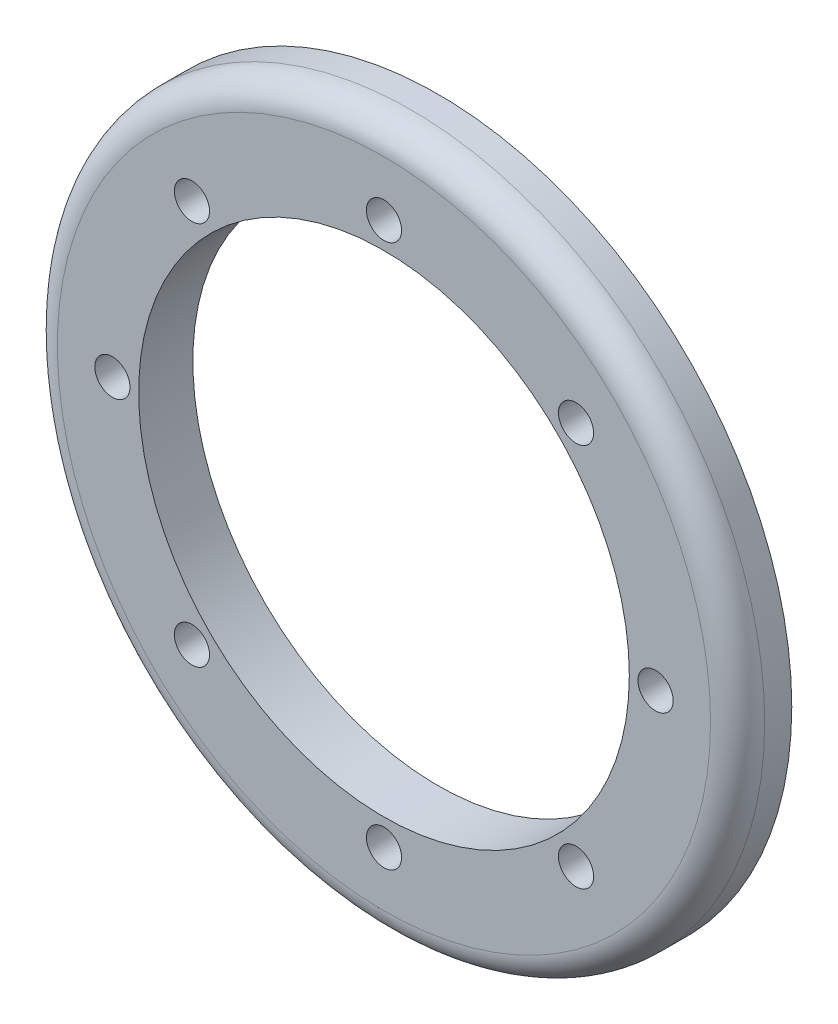
from build123d import *

# Parameters (mm, degrees)
SKETCH1_R           = 65.3
SKETCH1_R_2         = 45.3
SKETCH1_R_3         = 1.65
BOSS_EXTRUDE1_DEPTH = 10
FILLET1_R           = 5
SKETCH2_R           = 3.25
CUT_EXTRUDE1_DEPTH  = 6


with BuildPart() as part:
    # Sketch1 → Boss-Extrude1 (new body)
    with BuildSketch(Plane.XY):
        Circle(SKETCH1_R)
        Circle(SKETCH1_R_2, mode=Mode.SUBTRACT)
        with Locations((35.461405077, -35.461405077)):
            Circle(SKETCH1_R_3, mode=Mode.SUBTRACT)
        with Locations((0, -50.15)):
            Circle(SKETCH1_R_3, mode=Mode.SUBTRACT)
        with Locations((-35.461405077, -35.461405077)):
            Circle(SKETCH1_R_3, mode=Mode.SUBTRACT)
        with Locations((-50.15, 0)):
            Circle(SKETCH1_R_3, mode=Mode.SUBTRACT)
        with Locations((-35.461405077, 35.461405077)):
            Circle(SKETCH1_R_3, mode=Mode.SUBTRACT)
        with Locations((0, 50.15)):
            Circle(SKETCH1_R_3, mode=Mode.SUBTRACT)
        with Locations((35.461405077, 35.461405077)):
            Circle(SKETCH1_R_3, mode=Mode.SUBTRACT)
        with Locations((50.15, 0)):
            Circle(SKETCH1_R_3, mode=Mode.SUBTRACT)
    extrude(amount=BOSS_EXTRUDE1_DEPTH)

    # Fillet1
    fillet1_edges = [part.edges().sort_by_distance(p)[0] for p in [
        (-65.3, 0, 10),
    ]]
    fillet(fillet1_edges, radius=FILLET1_R)

    # Sketch2 → Cut-Extrude1 (cut)
    with BuildSketch(Plane.XY.offset(10)):
        with Locations((-50.15, 0)):
            Circle(SKETCH2_R)
        with Locations((-35.461405077, -35.461405077)):
            Circle(SKETCH2_R)
        with Locations((-35.461405077, 35.461405077)):
            Circle(SKETCH2_R)
        with Locations((0, 50.15)):
            Circle(SKETCH2_R)
        with Locations((35.461405077, 35.461405077)):
            Circle(SKETCH2_R)
        with Locations((50.15, 0)):
            Circle(SKETCH2_R)
        with Locations((35.461405077, -35.461405077)):
            Circle(SKETCH2_R)
        with Locations((0, -50.15)):
            Circle(SKETCH2_R)
    extrude(amount=-CUT_EXTRUDE1_DEPTH, mode=Mode.SUBTRACT)


solid = part.part
